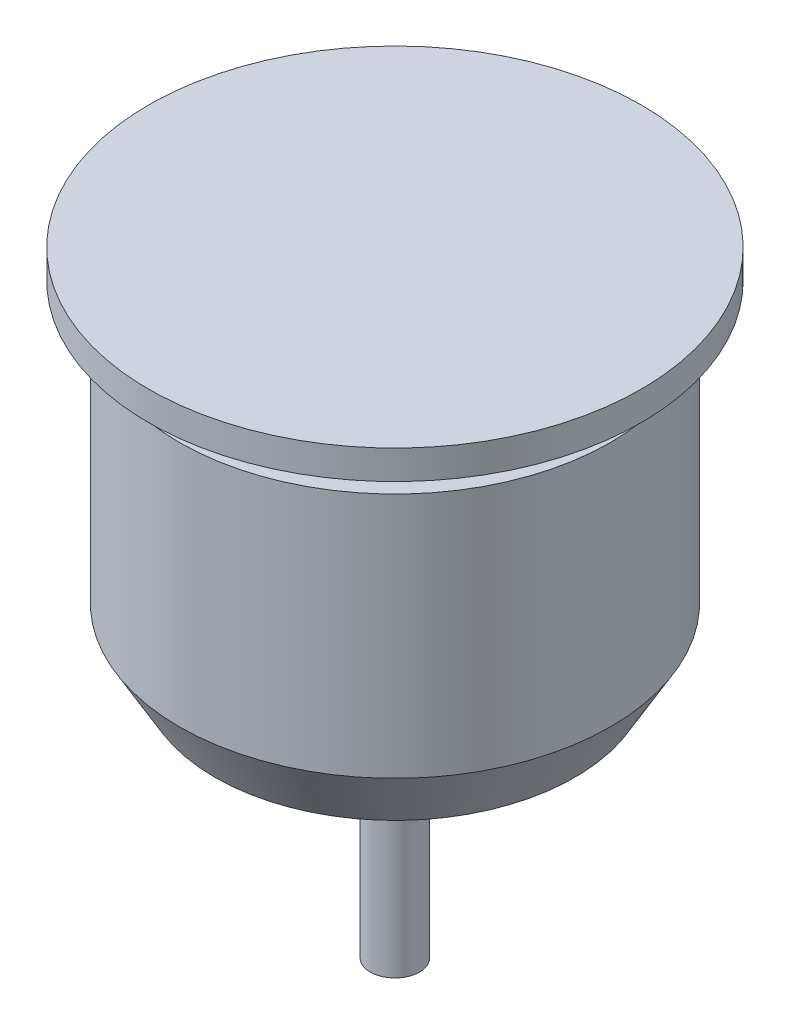
from build123d import *


with BuildPart() as part:
    # Skica1 → Rotovat1 (revolve)
    with BuildSketch(Plane.XY, mode=Mode.PRIVATE) as rotovat1_sk:
        Polygon((0, 0), (2, 0), (2, 20), (14.613248654, 20), (17.5, 25), (17.5, 45), (14.5, 45), (14.5, 29), (0, 29), align=None)
    revolve(rotovat1_sk.sketch.rotate(Axis((0, 0, 0), (0, 1, 0)), 90), axis=Axis((0, 0, 0), (0, 1, 0)))


with BuildPart() as body_2:
    # Skica2 → Rotovat2 (revolve)
    with BuildSketch(Plane.XY, mode=Mode.PRIVATE) as rotovat2_sk:
        Polygon((0, 30.576655738), (1.899727241, 30.576655738), (1.899727241, 32.648069176), (12.532982887, 32.648069176), (12.532982887, 45), (1.899727241, 45), (1.899727241, 47.643201742), (20, 47.643201742), (20, 50), (0, 50), align=None)
    revolve(rotovat2_sk.sketch.rotate(Axis((0, 0, 0), (0, 1, 0)), 90), axis=Axis((0, 0, 0), (0, 1, 0)))


solid = Compound([part.part, body_2.part])
